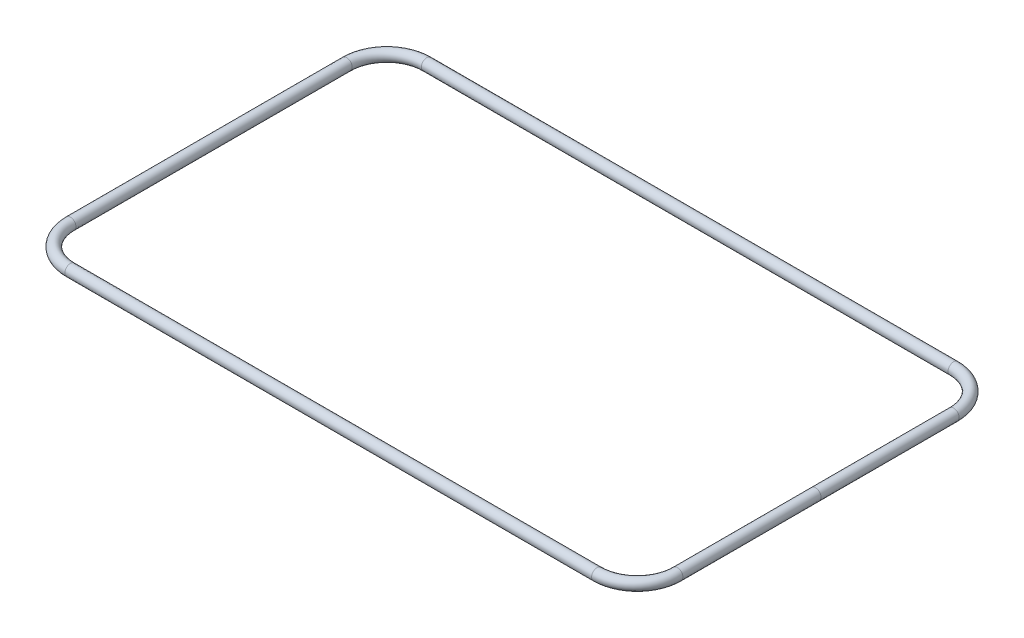
from build123d import *

# Parameters (mm, degrees)
O_RINGPROFILE_R = 1.7653


with BuildPart() as part:
    # Sweep2: sweep along a path in O-RingPath
    with BuildLine(Plane(origin=(0, 0, 0), x_dir=(1, 0, 0), z_dir=(0, 1, 0))) as sweep2_path:
        Line((83.396775144, -56.4388), (-83.396775144, -56.4388))
        ThreePointArc((-83.396775144, -56.4388), (-92.377031265, -52.719056121), (-96.096775144, -43.7388))
        Line((-96.096775144, -43.7388), (-96.096775144, 43.7388))
        ThreePointArc((-96.096775144, 43.7388), (-92.377031265, 52.719056121), (-83.396775144, 56.4388))
        Line((-83.396775144, 56.4388), (83.396775144, 56.4388))
        ThreePointArc((83.396775144, 56.4388), (92.377031265, 52.719056121), (96.096775144, 43.7388))
        Line((96.096775144, 43.7388), (96.096775144, -43.7388))
        ThreePointArc((96.096775144, -43.7388), (92.377031265, -52.719056121), (83.396775144, -56.4388))
    # O-RingProfile → Sweep2 (sweep)
    with BuildSketch(Plane.XY):
        with Locations((96.096775144, 0)):
            Circle(O_RINGPROFILE_R)
    sweep(path=sweep2_path.line)


solid = part.part
